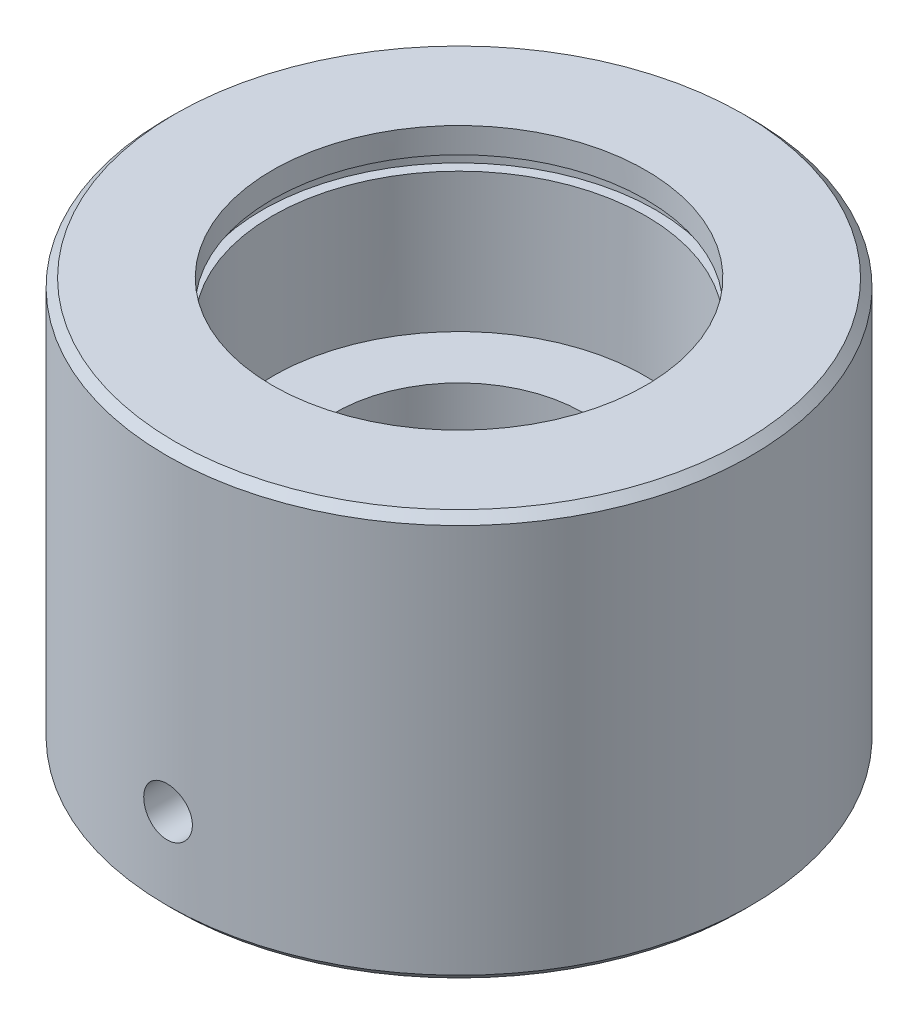
from build123d import *

# Parameters (mm, degrees)
SKETCH1_R               = 36
BOSS_EXTRUDE1_DEPTH     = 50
SKETCH2_R               = 23
CUT_EXTRUDE1_DEPTH      = 22
SKETCH3_R               = 14
CUT_EXTRUDE2_DEPTH      = 22
SKETCH4_R               = 15.25
CUT_EXTRUDE3_DEPTH      = 6
SKETCH5_W               = 1.25
SKETCH5_H               = 1.75
CUT_EXTRUDE4_DEPTH      = 72.3582511
CUT_EXTRUDE4_DEPTH_BACK = 72.3582511
SKETCH6_R               = 3
CHAMFER1_SIZE           = 1


with BuildPart() as part:
    # Sketch1 → Boss-Extrude1 (new body)
    with BuildSketch(Plane(origin=(0, 0, 0), x_dir=(1, 0, 0), z_dir=(0, 1, 0))):
        with Locations(Location((0, 0, 0), (0, 0, 270))):
            Circle(SKETCH1_R)
    extrude(amount=BOSS_EXTRUDE1_DEPTH)

    # Sketch2 → Cut-Extrude1 (cut)
    with BuildSketch(Plane(origin=(0, 50, 0), x_dir=(1, 0, 0), z_dir=(0, 1, 0))):
        with Locations(Location((0, 0, 0), (0, 0, 270))):
            Circle(SKETCH2_R)
    extrude(amount=-CUT_EXTRUDE1_DEPTH, mode=Mode.SUBTRACT)

    # Sketch3 → Cut-Extrude2 (cut)
    with BuildSketch(Plane.XZ):
        with Locations(Location((0, 0, 0), (0, 0, 270))):
            Circle(SKETCH3_R)
    extrude(amount=-CUT_EXTRUDE2_DEPTH, mode=Mode.SUBTRACT)

    # Sketch4 → Cut-Extrude3 (cut)
    with BuildSketch(Plane(origin=(0, 28, 0), x_dir=(1, 0, 0), z_dir=(0, 1, 0))):
        with Locations(Location((0, 0, 0), (0, 0, 270))):
            Circle(SKETCH4_R)
    extrude(amount=-CUT_EXTRUDE3_DEPTH, mode=Mode.SUBTRACT)

    # Sketch5 → Cut-Revolve1 (revolve, cut)
    with BuildSketch(Plane.XY, mode=Mode.PRIVATE) as cut_revolve1_sk:
        with Locations((23.625, 46)):
            Rectangle(SKETCH5_W, SKETCH5_H)
    revolve(cut_revolve1_sk.sketch.rotate(Axis((0, 0, 0), (0, 1, 0)), 270), axis=Axis((0, 0, 0), (0, 1, 0)), mode=Mode.SUBTRACT)

    # Sketch6 → Cut-Extrude4 (cut, two sides: drawn at the far end of the back side and taken through both)
    with BuildSketch(Plane.XY.offset(-CUT_EXTRUDE4_DEPTH_BACK)):
        with Locations((0, 11)):
            Circle(SKETCH6_R)
    extrude(amount=CUT_EXTRUDE4_DEPTH + CUT_EXTRUDE4_DEPTH_BACK, mode=Mode.SUBTRACT)

    # Chamfer1
    chamfer1_edges = [part.edges().sort_by_distance(p)[0] for p in [
        (0, 0, -36),
        (0, 50, -36),
    ]]
    chamfer(chamfer1_edges, length=CHAMFER1_SIZE)


solid = part.part
